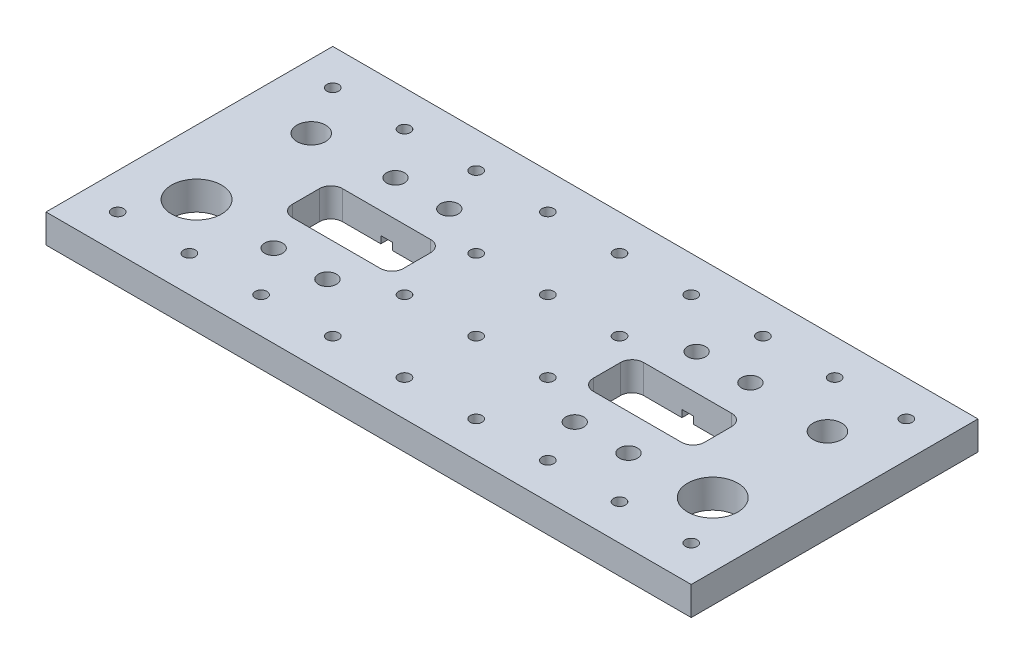
from build123d import *

# Parameters (mm, degrees)
SKETCH1_W           = 180
SKETCH1_H           = 80
BOSS_EXTRUDE1_DEPTH = 8
SKETCH2_R           = 4
SKETCH2_R_2         = 7
SKETCH2_W           = 31
SKETCH2_H           = 14
CUT_EXTRUDE1_DEPTH  = 30
FILLET1_R           = 3.2
SKETCH5_R           = 1.65
CUT_EXTRUDE4_DEPTH  = 8
SKETCH3_W           = 3.2
SKETCH3_H           = 20
CUT_EXTRUDE5_DEPTH  = 2
SKETCH7_R           = 2.5
CUT_EXTRUDE6_DEPTH  = 198.139544486


with BuildPart() as part:
    # Sketch1 → Boss-Extrude1 (new body)
    with BuildSketch(Plane(origin=(0, 0, 0), x_dir=(1, 0, 0), z_dir=(0, 1, 0))):
        with Locations((90, -40)):
            Rectangle(SKETCH1_W, SKETCH1_H)
    extrude(amount=BOSS_EXTRUDE1_DEPTH)

    # Sketch2 → Cut-Extrude1 (cut)
    with BuildSketch(Plane(origin=(0, 8, 0), x_dir=(1, 0, 0), z_dir=(0, 1, 0))):
        with Locations(Location((18, -24, 0), (0, 0, 270))):
            Circle(SKETCH2_R)
        with Locations(Location((162, -24, 0), (0, 0, 270))):
            Circle(SKETCH2_R)
        with Locations(Location((18, -56, 0), (0, 0, 270))):
            Circle(SKETCH2_R_2)
        with Locations(Location((162, -56, 0), (0, 0, 270))):
            Circle(SKETCH2_R_2)
        with Locations((132, -40)):
            Rectangle(SKETCH2_W, SKETCH2_H)
        with Locations((48, -40)):
            Rectangle(SKETCH2_W, SKETCH2_H)
    extrude(amount=-CUT_EXTRUDE1_DEPTH, mode=Mode.SUBTRACT)

    # Fillet1
    fillet1_edges = [part.edges().sort_by_distance(p)[0] for p in [
        (32.5, 4, 47),
        (32.5, 4, 33),
        (63.5, 4, 33),
        (63.5, 4, 47),
        (116.5, 4, 33),
        (147.5, 4, 33),
        (147.5, 4, 47),
        (116.5, 4, 47),
    ]]
    fillet(fillet1_edges, radius=FILLET1_R)

    # Sketch5 → Cut-Extrude4 (cut)
    with BuildSketch(Plane(origin=(0, 8, 0), x_dir=(1, 0, 0), z_dir=(0, 1, 0))):
        with Locations(Location((90, -10, 0), (0, 0, 270))):
            Circle(SKETCH5_R)
        with Locations(Location((70, -10, 0), (0, 0, 270))):
            Circle(SKETCH5_R)
        with Locations(Location((50, -10, 0), (0, 0, 270))):
            Circle(SKETCH5_R)
        with Locations(Location((30, -10, 0), (0, 0, 270))):
            Circle(SKETCH5_R)
        with Locations(Location((10, -10, 0), (0, 0, 270))):
            Circle(SKETCH5_R)
        with Locations(Location((170, -10, 0), (0, 0, 90))):
            Circle(SKETCH5_R)
        with Locations(Location((150, -10, 0), (0, 0, 90))):
            Circle(SKETCH5_R)
        with Locations(Location((130, -10, 0), (0, 0, 90))):
            Circle(SKETCH5_R)
        with Locations(Location((110, -10, 0), (0, 0, 90))):
            Circle(SKETCH5_R)
        with Locations(Location((170, -70, 0), (0, 0, 270))):
            Circle(SKETCH5_R)
        with Locations(Location((150, -70, 0), (0, 0, 270))):
            Circle(SKETCH5_R)
        with Locations(Location((130, -70, 0), (0, 0, 270))):
            Circle(SKETCH5_R)
        with Locations(Location((110, -70, 0), (0, 0, 270))):
            Circle(SKETCH5_R)
        with Locations(Location((90, -70, 0), (0, 0, 90))):
            Circle(SKETCH5_R)
        with Locations(Location((70, -70, 0), (0, 0, 90))):
            Circle(SKETCH5_R)
        with Locations(Location((50, -70, 0), (0, 0, 90))):
            Circle(SKETCH5_R)
        with Locations(Location((30, -70, 0), (0, 0, 90))):
            Circle(SKETCH5_R)
        with Locations(Location((10, -70, 0), (0, 0, 90))):
            Circle(SKETCH5_R)
        with Locations(Location((90, -30, 0), (0, 0, 270))):
            Circle(SKETCH5_R)
        with Locations(Location((90, -50, 0), (0, 0, 90))):
            Circle(SKETCH5_R)
        with Locations(Location((70, -50, 0), (0, 0, 270))):
            Circle(SKETCH5_R)
        with Locations(Location((70, -30, 0), (0, 0, 90))):
            Circle(SKETCH5_R)
        with Locations(Location((110, -50, 0), (0, 0, 270))):
            Circle(SKETCH5_R)
        with Locations(Location((110, -30, 0), (0, 0, 90))):
            Circle(SKETCH5_R)
    extrude(amount=-CUT_EXTRUDE4_DEPTH, mode=Mode.SUBTRACT)

    # Sketch3 → Cut-Extrude5 (cut)
    with BuildSketch(Plane.XZ):
        with Locations((48, 23)):
            Rectangle(SKETCH3_W, SKETCH3_H)
        with Locations((48, 57)):
            Rectangle(SKETCH3_W, SKETCH3_H)
        with Locations((132, 23)):
            Rectangle(SKETCH3_W, SKETCH3_H)
        with Locations((132, 57)):
            Rectangle(SKETCH3_W, SKETCH3_H)
    extrude(amount=-CUT_EXTRUDE5_DEPTH, mode=Mode.SUBTRACT)

    # Sketch7 → Cut-Extrude6 (cut, through all)
    with BuildSketch(Plane.XZ):
        with Locations(Location((40.5, 57, 0), (0, 0, 270))):
            Circle(SKETCH7_R)
        with Locations(Location((55.5, 57, 0), (0, 0, 90))):
            Circle(SKETCH7_R)
        with Locations(Location((55.5, 23, 0), (0, 0, 270))):
            Circle(SKETCH7_R)
        with Locations(Location((40.5, 23, 0), (0, 0, 90))):
            Circle(SKETCH7_R)
        with Locations(Location((124.5, 23, 0), (0, 0, 90))):
            Circle(SKETCH7_R)
        with Locations(Location((139.5, 23, 0), (0, 0, 270))):
            Circle(SKETCH7_R)
        with Locations(Location((124.5, 57, 0), (0, 0, 270))):
            Circle(SKETCH7_R)
        with Locations(Location((139.5, 57, 0), (0, 0, 90))):
            Circle(SKETCH7_R)
    extrude(amount=-CUT_EXTRUDE6_DEPTH, mode=Mode.SUBTRACT)


solid = part.part
